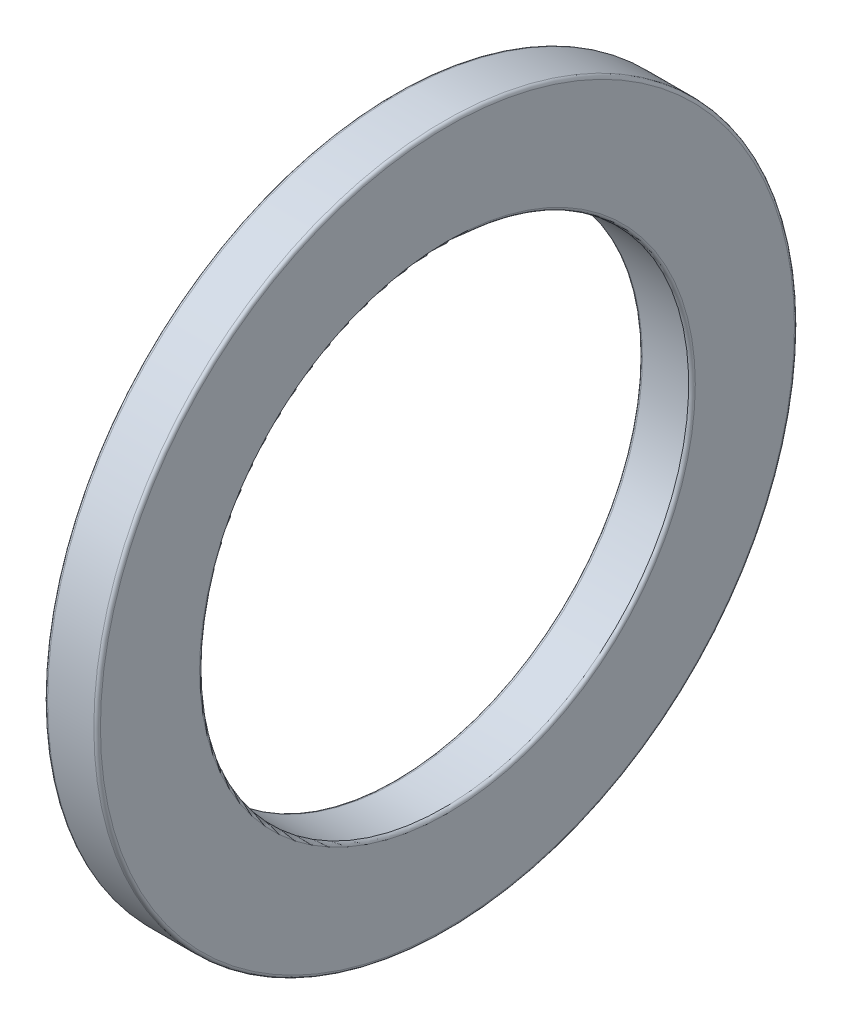
from build123d import *

# Parameters (mm, degrees)
FILLET_1_R = 0.5


with BuildPart() as part:
    # Эскиз1 → Повернуть1 (revolve)
    with BuildSketch(Plane.XY, mode=Mode.PRIVATE) as revolve_1_sk:
        with BuildLine():
            Line((0, 37), (8, 37))
            Line((8, 37), (8, 53))
            Line((8, 53), (0, 53))
            Line((0, 53), (0, 48.464101615))
            ThreePointArc((0, 48.464101615), (3, 45), (0, 41.535898385))
            Line((0, 41.535898385), (0, 37))
        make_face()
    revolve(revolve_1_sk.sketch.rotate(Axis((0, 0, 0), (1, 0, 0)), 90), axis=Axis((0, 0, 0), (1, 0, 0)))

    # Скругление1
    fillet_1_edges = [part.edges().sort_by_distance(p)[0] for p in [
        (0, 0, -53),
        (8, 0, -53),
        (8, 0, -37),
        (0, 0, -37),
    ]]
    fillet(fillet_1_edges, radius=FILLET_1_R)


solid = part.part
